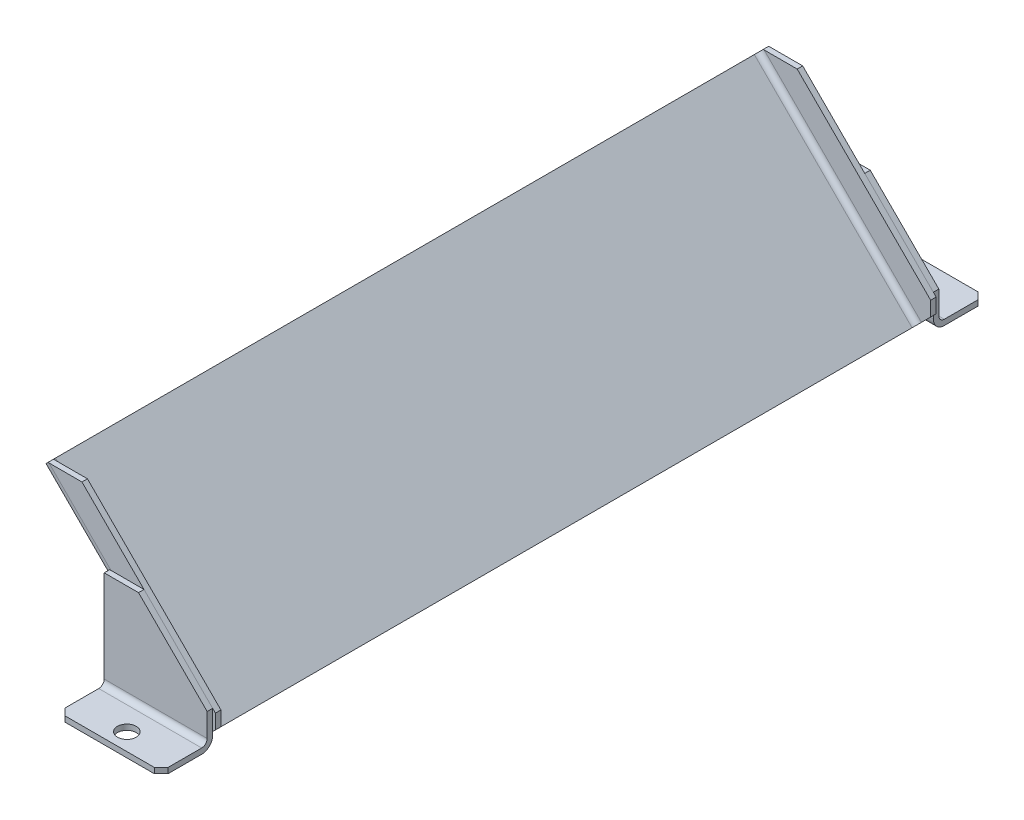
from build123d import *

# Parameters (mm, degrees)
BOSS_EXTRUDE1_DEPTH           = 30
FILLET1_R                     = 1.6
FILLET2_R                     = 3.2
CUT_EXTRUDE1_DEPTH            = 120
CHAMFER1_SIZE                 = 2
CUT_EXTRUDE2_DEPTH            = 105
SHELL1_T                      = -1.6
FILLET3_R                     = 1.6
FILLET4_R                     = 3.2
CHAMFER2_SIZE                 = 7
CHAMFER3_SIZE                 = 3
SKETCH5_W                     = 2.75
SKETCH5_H                     = 1.6
M5_CLEARANCE_HOLE1_AT_2_COUNT = 2
M5_CLEARANCE_HOLE1_AT_2_PITCH = 230


with BuildPart() as part:
    # Sketch1 → Boss-Extrude1 (new body)
    with BuildSketch(Plane(origin=(0, 0, 0), x_dir=(0, 0, -1), z_dir=(1, 0, 0))):
        Polygon((-120, 0), (-105, 0), (-105, 30), (-106.6, 30), (-106.6, 1.6), (-120, 1.6), align=None)
    extrude(amount=BOSS_EXTRUDE1_DEPTH)

    # Fillet1
    fillet1_edges = [part.edges().sort_by_distance(p)[0] for p in [
        (15, 1.6, 106.6),
    ]]
    fillet(fillet1_edges, radius=FILLET1_R)

    # Fillet2
    fillet2_edges = [part.edges().sort_by_distance(p)[0] for p in [
        (15, 0, 105),
    ]]
    fillet(fillet2_edges, radius=FILLET2_R)

    # Sketch2 → Cut-Extrude1 (cut)
    with BuildSketch(Plane.XY):
        Polygon((10, 30), (33, 7), (33, 33), (10, 33), align=None)
    extrude(amount=CUT_EXTRUDE1_DEPTH, mode=Mode.SUBTRACT)

    # Chamfer1
    chamfer1_edges = [part.edges().sort_by_distance(p)[0] for p in [
        (30, 0.8, 120),
        (0, 0.8, 120),
    ]]
    chamfer(chamfer1_edges, length=CHAMFER1_SIZE)


with BuildPart() as body_2:
    # Sketch3 → Cut-Extrude2 (new, symmetric)
    with BuildSketch(Plane.XY):
        Polygon((-20.104076401, 45.961940777), (25.857864376, 0), (32.928932188, 7.071067812), (-13.033008589, 53.033008589), align=None)
    extrude(amount=CUT_EXTRUDE2_DEPTH, both=True)

    # Shell1
    shell1_openings = [body_2.faces().sort_by_distance(p)[0] for p in [
        (9.9479618, 30.0520382, 0),
        (29.393398282, 3.535533906, 0),
        (-16.568542495, 49.497474683, 0),
    ]]
    offset(amount=SHELL1_T, openings=shell1_openings, kind=Kind.INTERSECTION)

    # Fillet3
    fillet3_edges = [body_2.edges().sort_by_distance(p)[0] for p in [
        (4.008264838, 24.112341238, -103.4),
        (4.008264838, 24.112341238, 103.4),
    ]]
    fillet(fillet3_edges, radius=FILLET3_R)

    # Fillet4
    fillet4_edges = [body_2.edges().sort_by_distance(p)[0] for p in [
        (2.876893988, 22.980970389, -105),
        (2.876893988, 22.980970389, 105),
    ]]
    fillet(fillet4_edges, radius=FILLET4_R)

    # Chamfer2
    chamfer2_edges = [body_2.edges().sort_by_distance(p)[0] for p in [
        (-13.033008589, 53.033008589, -104.2),
        (-13.033008589, 53.033008589, 104.2),
    ]]
    chamfer(chamfer2_edges, length=CHAMFER2_SIZE)

    # Chamfer3
    chamfer3_edges = [body_2.edges().sort_by_distance(p)[0] for p in [
        (32.928932188, 7.071067812, -104.2),
        (32.928932188, 7.071067812, 104.2),
    ]]
    chamfer(chamfer3_edges, length=CHAMFER3_SIZE)


with BuildPart() as body_3:
    # MirrorSolid1: mirrored copy
    add(part.part.mirror(Plane.XY))


with BuildPart() as part_1:
    add(part.part)

    # Sketch5 → M5 Clearance Hole1 (revolve, cut)
    with BuildSketch(Plane(origin=(15, 1.6, 115), x_dir=(0, 0, 1), z_dir=(1, 0, 0))):
        with Locations((1.375, 0.8)):
            Rectangle(SKETCH5_W, SKETCH5_H)
    m5_clearance_hole1 = revolve(axis=Axis((15, 7.95, 115), (0, -1, 0)), mode=Mode.SUBTRACT)


with BuildPart() as body_3_1:
    add(body_3.part)

    # M5 Clearance Hole1 at 2: M5 Clearance Hole1 ×2
    with Locations(*[(0, 0, -i * M5_CLEARANCE_HOLE1_AT_2_PITCH) for i in range(1, M5_CLEARANCE_HOLE1_AT_2_COUNT)]):
        add(m5_clearance_hole1, mode=Mode.SUBTRACT)


solid = Compound([body_2.part, part_1.part, body_3_1.part])
